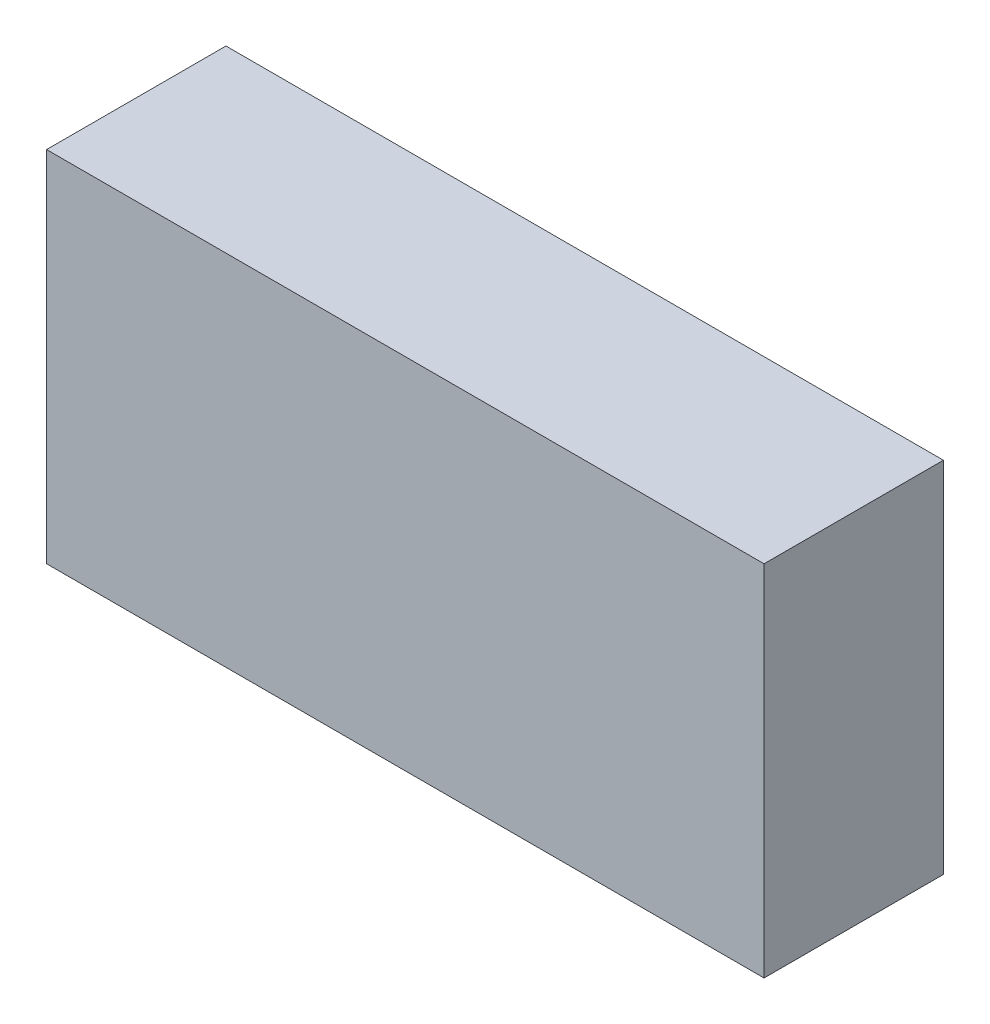
from build123d import *

# Parameters (mm, degrees)
SKETCH_1_W      = 20
SKETCH_1_H      = 10
EXTRUDE_1_DEPTH = 5


with BuildPart() as part:
    # 草图1 → 凸台-拉伸1 (new body)
    with BuildSketch(Plane.XY):
        Rectangle(SKETCH_1_W, SKETCH_1_H)
    extrude(amount=EXTRUDE_1_DEPTH)


solid = part.part
